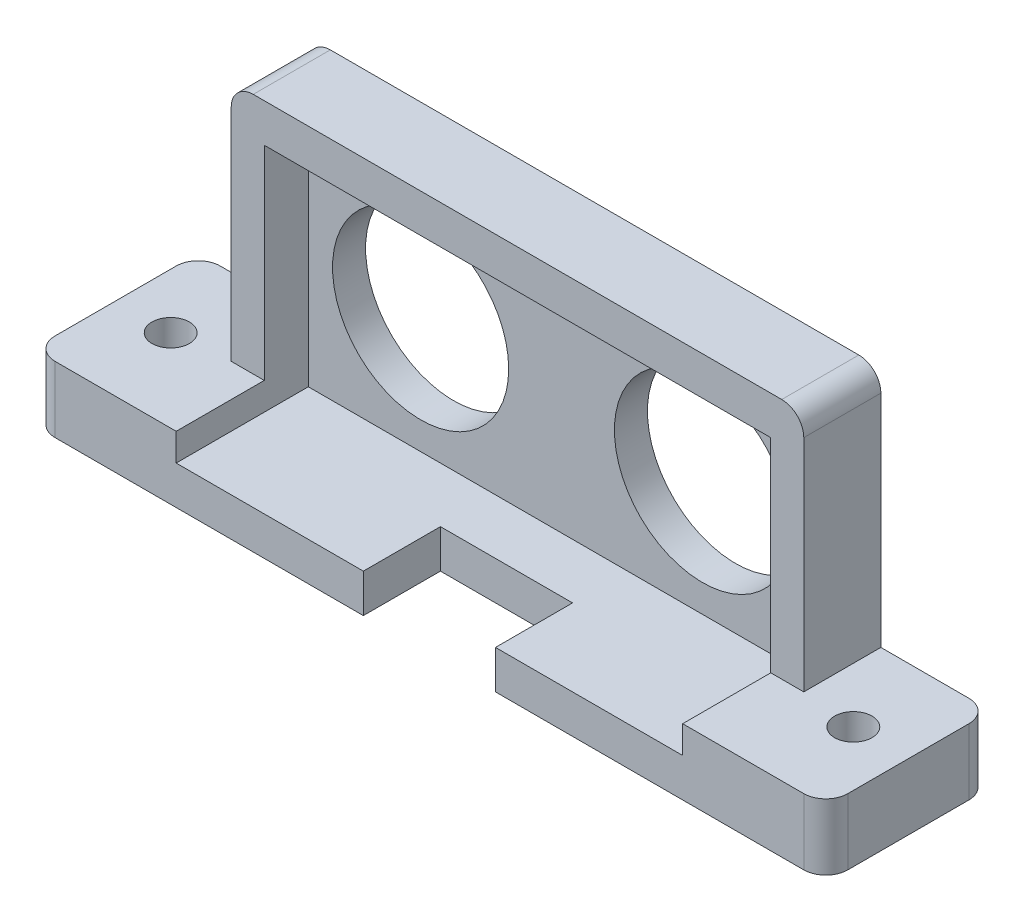
from build123d import *

# Parameters (mm, degrees)
BOSS_EXTRU_1_DEPTH      = 15
ESQUISSE2_W             = 46
ESQUISSE2_H             = 21
ENL_V_MAT_EXTRU_1_DEPTH = 12
ESQUISSE4_R             = 8
ENL_V_MAT_EXTRU_2_DEPTH = 3
ENL_V_MAT_EXTRU_3_REACH = 50.01
ESQUISSE5_W             = 12
ESQUISSE5_H             = 7
CONG_1_R                = 2
D_GAGEMENT_M31_D        = 3.4
ENL_V_MAT_EXTRU_4_REACH = 71.663
ESQUISSE10_W            = 8
ESQUISSE10_H            = 25


with BuildPart() as part:
    # Esquisse1 → Boss.-Extru.1 (new body)
    with BuildSketch(Plane.XY):
        Polygon((36, 0), (-36, 0), (-36, 6), (-26, 6), (-26, 28), (26, 28), (26, 6), (36, 6), align=None)
    extrude(amount=BOSS_EXTRU_1_DEPTH)

    # Esquisse2 → Enlèv. mat.-Extru.1 (cut)
    with BuildSketch(Plane.XY.offset(15)):
        with Locations((0, 14)):
            Rectangle(ESQUISSE2_W, ESQUISSE2_H)
    extrude(amount=-ENL_V_MAT_EXTRU_1_DEPTH, mode=Mode.SUBTRACT)

    # Esquisse4 → Enlèv. mat.-Extru.2 (cut)
    with BuildSketch(Plane.XY.offset(3)):
        with Locations((-12.8, 14)):
            Circle(ESQUISSE4_R)
        with Locations((12.8, 14)):
            Circle(ESQUISSE4_R)
    extrude(amount=-ENL_V_MAT_EXTRU_2_DEPTH, mode=Mode.SUBTRACT)

    # Enlèv. mat.-Extru.3: up to this face of the body (flat: up to its plane)
    enl_v_mat_extru_3_end = Plane(part.part.faces().sort_by_distance((0, 28, 7.5))[0])
    # Esquisse5 → Enlèv. mat.-Extru.3 (cut, up to the picked face)
    with BuildSketch(Plane.XZ, mode=Mode.PRIVATE) as enl_v_mat_extru_3_sk1:
        with Locations((0, 11.5)):
            Rectangle(ESQUISSE5_W, ESQUISSE5_H)
    enl_v_mat_extru_3_tool1 = split(extrude(enl_v_mat_extru_3_sk1.sketch, amount=-ENL_V_MAT_EXTRU_3_REACH, mode=Mode.PRIVATE), bisect_by=enl_v_mat_extru_3_end, keep=Keep.BOTH, mode=Mode.PRIVATE)
    add(enl_v_mat_extru_3_tool1.solids().sort_by(Axis((0, 0, 11.5), (0, 1, 0)))[0], mode=Mode.SUBTRACT)

    # Congé1
    cong_1_edges = [part.edges().sort_by_distance(p)[0] for p in [
        (36, 3, 0),
        (-36, 3, 0),
        (36, 3, 15),
        (-26, 28, 7.5),
        (26, 28, 7.5),
        (-36, 3, 15),
    ]]
    fillet(cong_1_edges, radius=CONG_1_R)

    # Dégagement M31 (through all)
    with Locations(Plane(origin=(0, 6, 0), x_dir=(1, 0, 0), z_dir=(0, 1, 0))):
        with Locations((-31, -7.5), (31, -7.5)):
            Hole(D_GAGEMENT_M31_D / 2)

    # Enlèv. mat.-Extru.4: up to this face of the body (flat: up to its plane)
    enl_v_mat_extru_4_end = Plane(part.part.faces().sort_by_distance((-26, 16, 7.5))[0])
    # Esquisse10 → Enlèv. mat.-Extru.4 (cut, up to the picked face)
    with BuildSketch(Plane(origin=(26, 0, 0), x_dir=(0, 0, -1), z_dir=(1, 0, 0)), mode=Mode.PRIVATE) as enl_v_mat_extru_4_sk1:
        with Locations((-11, 18.5)):
            Rectangle(ESQUISSE10_W, ESQUISSE10_H)
    enl_v_mat_extru_4_tool1 = split(extrude(enl_v_mat_extru_4_sk1.sketch, amount=-ENL_V_MAT_EXTRU_4_REACH, mode=Mode.PRIVATE), bisect_by=enl_v_mat_extru_4_end, keep=Keep.BOTH, mode=Mode.PRIVATE)
    add(enl_v_mat_extru_4_tool1.solids().sort_by(Axis((26, 18.5, 11), (-1, 0, 0)))[0], mode=Mode.SUBTRACT)


solid = part.part
